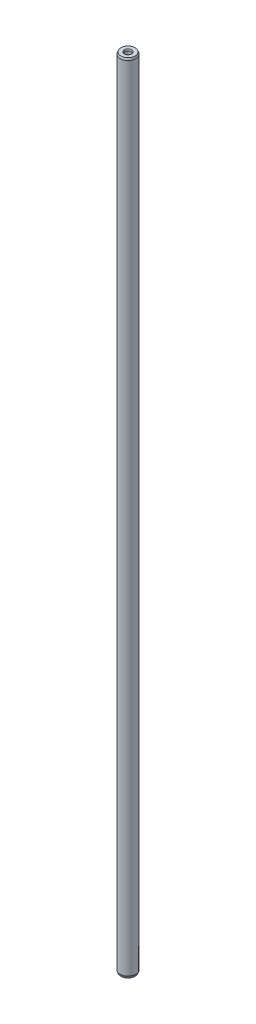
from build123d import *


with BuildPart() as part:
    # Sketch1 → Revolve1 (revolve)
    with BuildSketch(Plane(origin=(0, 0, -1.126435958), x_dir=(-1, 0, 0), z_dir=(0, 0, -1)), mode=Mode.PRIVATE) as revolve1_sk:
        Polygon((-0.064377258, -144.199063069), (1.065922742, -143.519910312), (1.065922742, 148.491784173), (-0.064377258, 149.170936931), (-0.064377258, 154.445996026), (-0.318377258, 154.885936931), (-1.677277258, 154.885936931), (-1.931277258, 154.123936931), (-1.931277258, -149.152063069), (-1.677277258, -149.914063069), (-0.318377258, -149.914063069), (-0.064377258, -149.474122164), align=None)
    revolve(revolve1_sk.sketch.rotate(Axis((-1.065922742, -149.914063069, -1.126435958), (0, 1, 0)), 270), axis=Axis((-1.065922742, -149.914063069, -1.126435958), (0, 1, 0)))


solid = part.part
